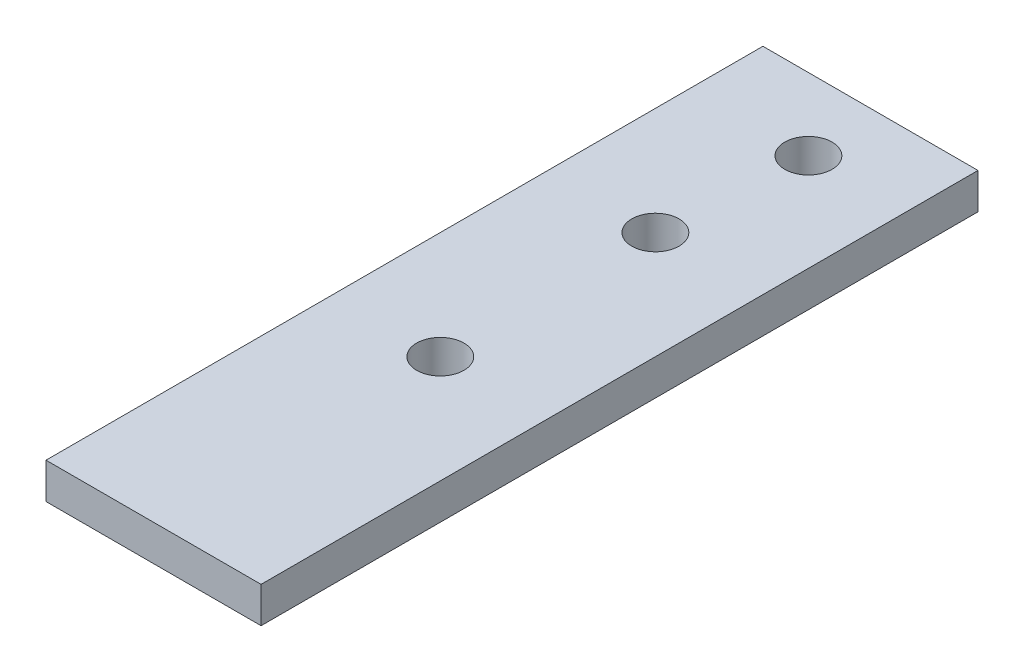
from build123d import *

# Parameters (mm, degrees)
SKETCH1_W           = 38.1
SKETCH1_H           = 88.9
SKETCH1_R           = 4.191
BOSS_EXTRUDE1_DEPTH = 6.35
SKETCH3_W           = 38.1
SKETCH3_H           = 6.35
BOSS_EXTRUDE2_DEPTH = 38.1


with BuildPart() as part:
    # Sketch1 → Boss-Extrude1 (new body)
    with BuildSketch(Plane(origin=(0, 0, 0), x_dir=(1, 0, 0), z_dir=(0, 1, 0))):
        with Locations((19.05, 44.45)):
            Rectangle(SKETCH1_W, SKETCH1_H)
        with Locations(Location((19.05, 12.7, 0), (0, 0, 270))):
            Circle(SKETCH1_R, mode=Mode.SUBTRACT)
        with Locations(Location((19.05, 50.8, 0), (0, 0, 270))):
            Circle(SKETCH1_R, mode=Mode.SUBTRACT)
        with Locations(Location((20.821814433, 76.138126877, 0), (0, 0, 270))):
            Circle(SKETCH1_R, mode=Mode.SUBTRACT)
    extrude(amount=BOSS_EXTRUDE1_DEPTH)

    # Sketch3 → Boss-Extrude2 (add)
    with BuildSketch(Plane.XY):
        with Locations((19.05, 3.175)):
            Rectangle(SKETCH3_W, SKETCH3_H)
    extrude(amount=BOSS_EXTRUDE2_DEPTH)


solid = part.part
